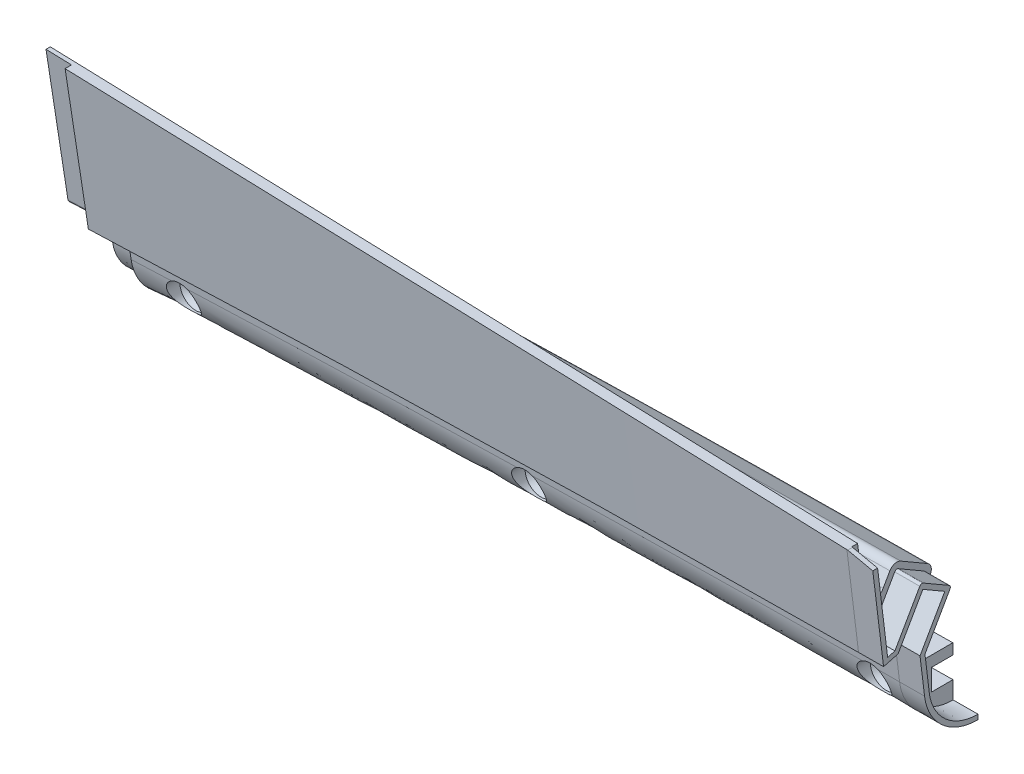
from build123d import *


with BuildPart() as part:
    # Sweep3: sweep along a path in Sketch3
    with BuildLine(Plane.XY.offset(101.6)) as sweep3_path:
        ThreePointArc((622.103936151, -83.199836272), (0, -43.636564626), (-622.103936151, -83.199836272))
    # Sketch4 → Sweep3 (sweep)
    with BuildSketch(Plane(origin=(-117.330566703, 4.430423936, 1117.6), x_dir=(0, 0, -1), z_dir=(0.9994536405585157, 0.03305178322465143, 0))):
        with BuildLine():
            Line((991.529482971, -5.453775083), (988.971801376, -5.453775083))
            Line((988.971801376, -5.453775083), (993.32506615, -42.283775083))
            Line((993.32506615, -42.283775083), (996.794703229, -41.354088728))
            Line((996.794703229, -41.354088728), (1002.763703229, -31.015013775))
            Line((1002.763703229, -31.015013775), (1007.999, -34.037749136))
            Line((1007.999, -34.037749136), (1002.03, -44.376824659))
            Line((1002.03, -44.376824659), (1003.077032208, -53.235049058))
            ThreePointArc((1003.077032208, -53.235049058), (1007.29752688, -61.276835992), (1015.8095, -64.443731312))
            Line((1015.8095, -64.443731312), (1015.8095, -59.12218153))
            Line((1015.8095, -59.12218153), (1010.7295, -59.12218153))
            Line((1010.7295, -59.12218153), (1010.7295, -54.041969025))
            Line((1010.7295, -54.041969025), (1015.8095, -54.041969025))
            Line((1015.8095, -54.041969025), (1015.8095, -51.501969025))
            Line((1015.8095, -51.501969025), (1007.687322123, -51.501969025))
            ThreePointArc((1007.687322123, -51.501969025), (1005.99997215, -50.860507955), (1005.164881483, -49.260118685))
            Line((1005.164881483, -49.260118685), (1004.750455768, -45.75394576))
            ThreePointArc((1004.750455768, -45.75394576), (1004.7850335, -44.943801809), (1005.073167189, -44.18583887))
            Line((1005.073167189, -44.18583887), (1010.516206197, -34.757795418))
            ThreePointArc((1010.516206197, -34.757795418), (1010.706497969, -33.312277166), (1009.818941274, -32.155567572))
            Line((1009.818941274, -32.155567572), (1003.483804566, -28.49781089))
            ThreePointArc((1003.483804566, -28.49781089), (1002.038222268, -28.307482122), (1000.881475684, -29.195102853))
            Line((1000.881475684, -29.195102853), (999.272416391, -31.982200293))
            ThreePointArc((999.272416391, -31.982200293), (996.560692883, -33.200105913), (994.550246564, -31.010392672))
            Line((994.550246564, -31.010392672), (991.529482971, -5.453775083))
        make_face()
    sweep(path=sweep3_path.line)

    # SurfaceCut1
    split(bisect_by=Plane(origin=(-211.442164364, -9.040193423, 0), x_dir=(0.04271589869142412, -0.9990872594518379, 0), z_dir=(-0.9990872594518379, -0.04271589869142412, 0)), keep=Keep.BOTTOM)

    # SurfaceCut2
    split(bisect_by=Plane(origin=(-26.153469653, -0.138061345, 0), x_dir=(-0.00527881858216647, 0.9999860669401233, 0), z_dir=(0.9999860669401233, 0.00527881858216647, 0)), keep=Keep.BOTTOM)

    # Sketch8 → Cut-Revolve1 (revolve, cut)
    with BuildSketch(Plane(origin=(-117.056038996, -3.871025798, 0), x_dir=(0, 0, -1), z_dir=(0.9994536405585157, 0.03305178322465143, 0)), mode=Mode.PRIVATE) as cut_revolve1_sk:
        Polygon((-119.5705, -48.27608749), (-106.8705, -48.27608749), (-106.8705, -46.37108749), (-108.7755, -46.37108749), (-110.6805, -44.46608749), (-119.5705, -44.46608749), align=None)
    cut_revolve1 = revolve(cut_revolve1_sk.sketch.rotate(Axis((-115.460428217, -52.120737191, 119.5705), (0, 0, -1)), 91.894072645), axis=Axis((-115.460428217, -52.120737191, 119.5705), (0, 0, -1)), mode=Mode.SUBTRACT)

    # Sketch-Pattern1: Cut-Revolve1 at 2 more places
    with Locations((82.543476, 1.248991, 0), (-82.510753, -2.638363, 0)):
        add(cut_revolve1, mode=Mode.SUBTRACT)

    # Sweep4: sweep along a path in Sketch12
    with BuildLine(Plane(origin=(0, 0, 101.7905), x_dir=(-1, 0, 0), z_dir=(0, 0, -1))) as sweep4_path:
        ThreePointArc((25.912690296, -45.749782589), (22.928194534, -45.734935062), (19.943690296, -45.721902098))
    # Sketch11 → Sweep4 (sweep)
    with BuildSketch(Plane(origin=(-26.153469653, -0.138061345, 0), x_dir=(0, 0, -1), z_dir=(0.9999860669401234, 0.005278818582166471, 0))):
        with BuildLine():
            Line((-101.7905, -57.410584718), (-101.7905, -58.553533473))
            add(Edge.make_bspline(
                [(-101.7905, -58.553533473), (-102.571330027, -58.560927658), (-103.340677537, -58.496812091), (-104.478193263, -58.297847089), (-104.85459633, -58.21428189), (-105.601773783, -58.012097714), (-105.974437358, -57.892723661), (-107.067422067, -57.48614599), (-107.762018779, -57.15223894), (-108.75418736, -56.559611087), (-109.076570448, -56.346677913), (-109.70425095, -55.889280968), (-110.009875034, -55.644252312), (-110.882225451, -54.876631772), (-111.411403795, -54.317352749), (-112.366195112, -53.104830197), (-112.794349261, -52.444859377), (-113.512952594, -51.077091402), (-113.807619255, -50.365922232), (-114.152305696, -49.258088293), (-114.251122313, -48.880714719), (-114.413580033, -48.117706551), (-114.477136038, -47.733092207), (-114.522967792, -47.345358558)],
                knots=[0, 0, 0, 0, 0.125, 0.125, 0.1875, 0.1875, 0.25, 0.25, 0.375, 0.375, 0.4375, 0.4375, 0.5, 0.5, 0.625, 0.625, 0.75, 0.75, 0.875, 0.875, 0.9375, 0.9375, 1, 1, 1, 1], degree=3))
            Line((-114.522967792, -47.345358558), (-115.57, -38.487533473))
            Line((-115.57, -38.487533473), (-109.601, -28.148922203))
            Line((-109.601, -28.148922203), (-114.836296771, -25.126322203))
            Line((-114.836296771, -25.126322203), (-120.805296771, -35.464933473))
            Line((-120.805296771, -35.464933473), (-124.27493385, -36.394578038))
            Line((-124.27493385, -36.394578038), (-128.628198624, 0.433778437))
            Line((-128.628198624, 0.433778437), (-127.477241199, 0.433778437))
            Line((-127.477241199, 0.433778437), (-123.294888708, -34.948670463))
            Line((-123.294888708, -34.948670463), (-121.558436986, -34.48341059))
            Line((-121.558436986, -34.48341059), (-115.572163807, -24.114881297))
            ThreePointArc((-115.572163807, -24.114881297), (-115.18658777, -23.819018398), (-114.704737676, -23.882455166))
            Line((-114.704737676, -23.882455166), (-108.589559095, -27.413055166))
            ThreePointArc((-108.589559095, -27.413055166), (-108.293696195, -27.798631204), (-108.357132963, -28.280481297))
            Line((-108.357132963, -28.280481297), (-114.390345193, -38.730311411))
            Line((-114.390345193, -38.730311411), (-113.38787021, -47.211185235))
            add(Edge.make_bspline(
                [(-101.801323322, -57.410584718), (-103.201893406, -57.423847624), (-106.035083238, -56.929017766), (-109.715936846, -54.728165855), (-111.931567303, -51.904742907), (-113.005394664, -49.313926742), (-113.304795542, -47.91399152), (-113.38787021, -47.211185235)],
                knots=[0, 0, 0, 0, 0.25, 0.5, 0.75, 0.875, 1, 1, 1, 1], degree=3))
            Line((-101.801323322, -57.410584718), (-101.7905, -57.410584718))
        make_face()
    sweep(path=sweep4_path.line)

    # Sweep5: sweep along a path in Sketch16
    with BuildLine(Plane(origin=(0, 0, 101.7905), x_dir=(-1, 0, 0), z_dir=(0, 0, -1))) as sweep5_path:
        ThreePointArc((215.647406705, -50.42045008), (212.665748146, -50.290245196), (209.684010975, -50.161853153))
    # Sketch15 → Sweep5 (sweep)
    with BuildSketch(Plane(origin=(-211.442164364, -9.040193423, 0), x_dir=(0, 0, 1), z_dir=(-0.9990872594518379, -0.04271589869142412, 0))):
        with BuildLine():
            Line((113.00950435, -42.713331456), (113.97237291, -34.567525415))
            ThreePointArc((113.97237291, -34.567525415), (113.963727961, -34.364981701), (113.891689273, -34.175484686))
            Line((113.891689273, -34.175484686), (107.519177285, -23.137970149))
            Line((107.519177285, -23.137970149), (115.394119486, -18.591370149))
            Line((115.394119486, -18.591370149), (121.677968823, -29.475316467))
            ThreePointArc((121.677968823, -29.475316467), (121.841334284, -29.661598015), (122.06355177, -29.771181218))
            Line((122.06355177, -29.771181218), (122.259394286, -29.823654698))
            ThreePointArc((122.259394286, -29.823654698), (122.780015415, -29.735923875), (123.054347243, -29.284830643))
            Line((123.054347243, -29.284830643), (127.093588723, 4.886907775))
            Line((127.093588723, 4.886907775), (126.070517029, 4.886907775))
            Line((126.070517029, 4.886907775), (123.049753436, -20.668571968))
            add(Edge.make_bspline(
                [(123.049753436, -20.668571968), (123.018406598, -20.933764287), (122.944898871, -21.192703381), (122.72486191, -21.671025374), (122.574983618, -21.89613649), (122.218479429, -22.283693321), (122.006878086, -22.451668909), (121.662818096, -22.646204147), (121.543504304, -22.701961436), (121.295473201, -22.795007288), (121.166493424, -22.832124521), (120.907997451, -22.885096572), (120.777385583, -22.901432856), (120.51342226, -22.913717924), (120.37910716, -22.909438417), (120.116311005, -22.880334184), (119.986998098, -22.855691982), (119.732512188, -22.786374688), (119.606266969, -22.741161694), (119.243601748, -22.578043456), (119.021351761, -22.432970621), (118.626712377, -22.076251458), (118.461102845, -21.871598209), (118.327583609, -21.640336089)],
                knots=[0, 0, 0, 0, 0.125, 0.125, 0.25, 0.25, 0.375, 0.375, 0.4375, 0.4375, 0.5, 0.5, 0.5625, 0.5625, 0.625, 0.625, 0.6875, 0.6875, 0.75, 0.75, 0.875, 0.875, 1, 1, 1, 1], degree=3))
            Line((118.327583609, -21.640336089), (116.718524316, -18.853363359))
            ThreePointArc((116.718524316, -18.853363359), (115.561765682, -17.965779092), (114.116195434, -18.156102576))
            Line((114.116195434, -18.156102576), (107.781058726, -21.813695606))
            ThreePointArc((107.781058726, -21.813695606), (106.893505265, -22.97034131), (107.083793803, -24.415806877))
            Line((107.083793803, -24.415806877), (112.526832811, -33.84342694))
            ThreePointArc((112.526832811, -33.84342694), (112.814966033, -34.601353512), (112.849544232, -35.411463252))
            Line((112.849544232, -35.411463252), (112.435118517, -38.917478209))
            ThreePointArc((112.435118517, -38.917478209), (111.600006373, -40.51781438), (109.912677877, -41.159227425))
            Line((109.912677877, -41.159227425), (101.7905, -41.159227425))
            Line((101.7905, -41.159227425), (101.7905, -43.699112741))
            Line((101.7905, -43.699112741), (106.8705, -43.699112741))
            Line((106.8705, -43.699112741), (106.8705, -48.779095512))
            Line((106.8705, -48.779095512), (101.7905, -48.779095512))
            Line((101.7905, -48.779095512), (101.7905, -52.576472462))
            Line((101.7905, -52.576472462), (101.804931097, -52.576472462))
            add(Edge.make_bspline(
                [(101.804931097, -52.576472462), (102.489279498, -52.582953001), (103.868868527, -52.467414443), (106.485766193, -51.75509811), (109.465837716, -49.976138537), (112.028433947, -46.715360308), (112.850511097, -44.058404026), (113.00950435, -42.713331456)],
                knots=[0, 0, 0, 0, 0.125, 0.25, 0.5, 0.75, 1, 1, 1, 1], degree=3))
        make_face()
    sweep(path=sweep5_path.line)

    # SurfaceCut3
    split(bisect_by=Plane(origin=(-0.611327415, -15.015577615, 0), x_dir=(-0.999172259551985, 0.04067918069210332, 0), z_dir=(-0.04067918069210332, -0.999172259551985, 0)), keep=Keep.TOP)

    # SurfaceCut4
    split(bisect_by=Plane(origin=(-4.881293776, -19.299927677, 0), x_dir=(-0.9694732813166054, 0.2451969755384725, 0), z_dir=(-0.2451969755384725, -0.9694732813166054, 0)), keep=Keep.TOP)


solid = part.part
